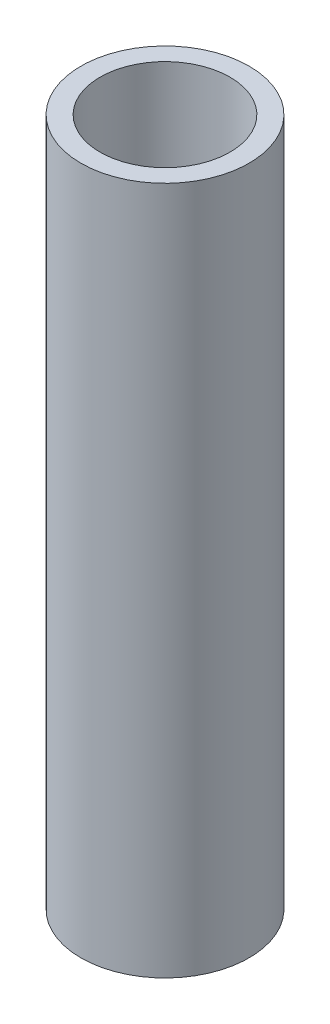
from build123d import *

# Parameters (mm, degrees)
SKETCH1_R           = 11
SKETCH1_R_2         = 8.5
BOSS_EXTRUDE1_DEPTH = 90


with BuildPart() as part:
    # Sketch1 → Boss-Extrude1 (new body)
    with BuildSketch(Plane(origin=(0, 0, 0), x_dir=(1, 0, 0), z_dir=(0, 1, 0))):
        with Locations(Location((0, 0, 0), (0, 0, 90))):
            Circle(SKETCH1_R)
        with Locations(Location((0, 0, 0), (0, 0, 90))):
            Circle(SKETCH1_R_2, mode=Mode.SUBTRACT)
    extrude(amount=BOSS_EXTRUDE1_DEPTH)


solid = part.part
